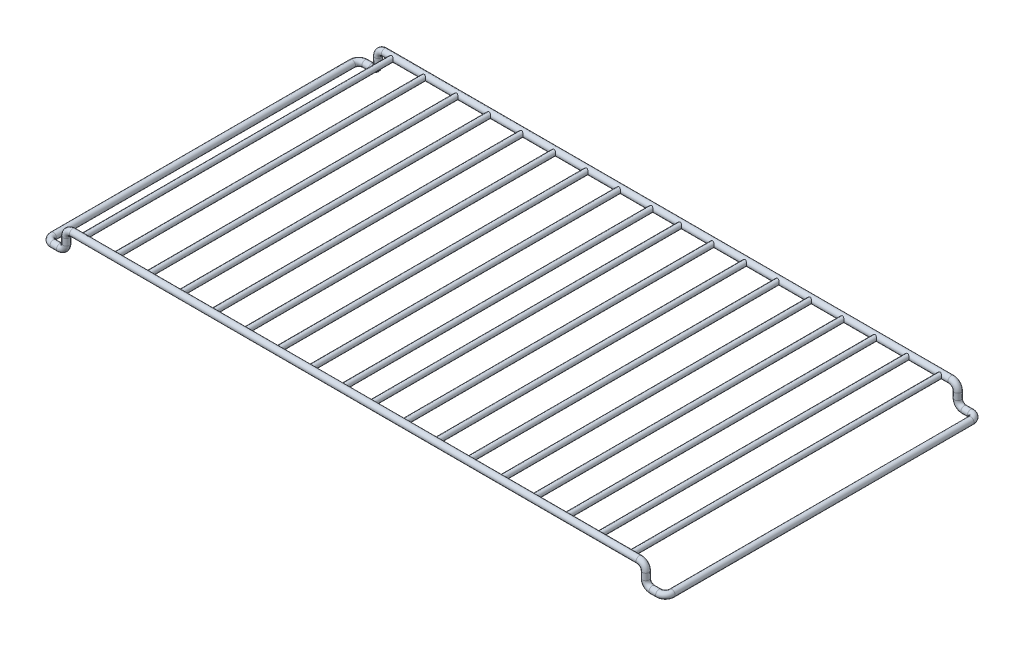
from build123d import *

# Parameters (mm, degrees)
SKETCH1_R                = 2.5
BOSS_EXTRUDE1_REACH      = 343.984
BOSS_EXTRUDE1_END_RADIUS = 2.5
SKETCH2_R                = 2
LPATTERN1_COUNT          = 9
LPATTERN1_PITCH          = 25


with BuildPart() as part:
    # Sweep1: sweep along a curve in space
    with BuildLine() as sweep1_path:
        Line((0, 0, 0), (218, 0, 0))
        ThreePointArc((218, 0, 0), (221.535533906, -1.464466094, 0), (223, -5, 0))
        Line((223, -5, 0), (223, -10, 0))
        ThreePointArc((223, -10, 0), (224.464466094, -13.535533906, 0), (228, -15, 0))
        Line((228, -15, 0), (233, -15, 0))
        ThreePointArc((233, -15, 0), (236.535533906, -15, -1.464466094), (238, -15, -5))
        Line((238, -15, -5), (238, -15, -235))
        ThreePointArc((238, -15, -235), (236.535533906, -15, -238.535533906), (233, -15, -240))
        Line((233, -15, -240), (228, -15, -240))
        ThreePointArc((228, -15, -240), (224.464466094, -13.535533906, -240), (223, -10, -240))
        Line((223, -10, -240), (223, -5, -240))
        ThreePointArc((223, -5, -240), (221.535533906, -1.464466094, -240), (218, 0, -240))
        Line((218, 0, -240), (0, 0, -240))
    # Sketch1 → Sweep1 (sweep)
    with BuildSketch(Plane(origin=(0, 0, 0), x_dir=(0, 0, -1), z_dir=(1, 0, 0))):
        Circle(SKETCH1_R)
    sweep(path=sweep1_path.line)

    # Boss-Extrude1: up to this cylinder (the profile starts outside it)
    boss_extrude1_end = Plane(origin=(11, 0, -240), z_dir=(-1, 0, 0)) * Cylinder(BOSS_EXTRUDE1_END_RADIUS, 693.968, mode=Mode.PRIVATE)
    # Sketch2 → Boss-Extrude1 (add, up to the surface)
    with BuildSketch(Plane.XY, mode=Mode.PRIVATE) as boss_extrude1_sk1:
        with Locations((11, 0)):
            Circle(SKETCH2_R)
    boss_extrude1_tool1 = extrude(boss_extrude1_sk1.sketch, amount=-BOSS_EXTRUDE1_REACH, mode=Mode.PRIVATE) - boss_extrude1_end
    boss_extrude1 = boss_extrude1_tool1.solids().sort_by_distance((11, 0, 0))[0]
    add(boss_extrude1)

    # LPattern1: Boss-Extrude1 ×9
    with Locations(*[(i * LPATTERN1_PITCH, 0, 0) for i in range(1, LPATTERN1_COUNT)]):
        add(boss_extrude1)

    # Mirror1: part across plane


with BuildPart() as part_1:
    add(part.part)
    add(part.part.mirror(Plane(origin=(0, 0, 0), x_dir=(0, 0, 1), z_dir=(1, 0, 0))))


solid = part_1.part
